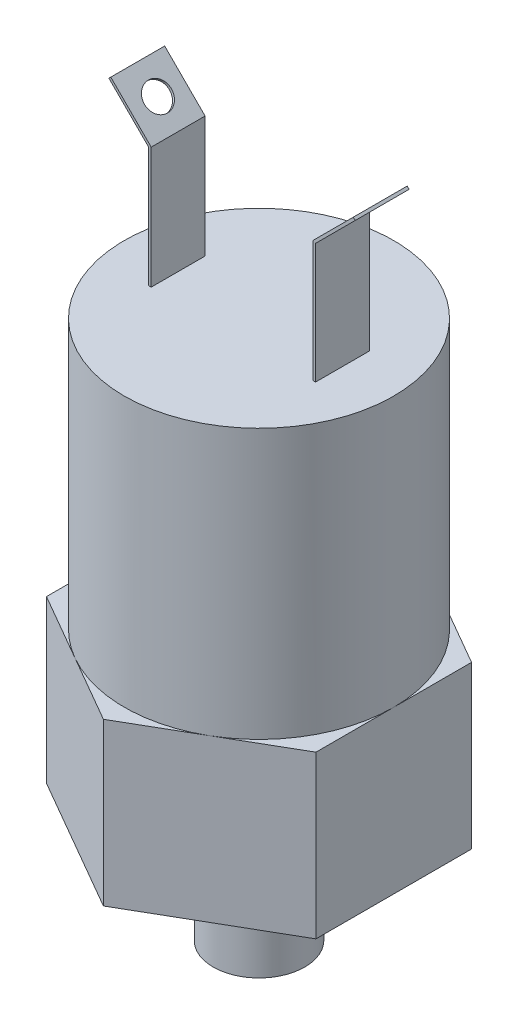
from build123d import *

# Parameters (mm, degrees)
SKETCH1_R           = 4.318
BOSS_EXTRUDE1_DEPTH = 10.16
BOSS_EXTRUDE2_DEPTH = 15.24
SKETCH3_R           = 12.7
BOSS_EXTRUDE3_DEPTH = 25.4
EXTRUDE_THIN1_DEPTH = 2.54
CUT_EXTRUDE1_REACH  = 59.583
SKETCH5_R           = 1.27


with BuildPart() as part:
    # Sketch1 → Boss-Extrude1 (new body)
    with BuildSketch(Plane(origin=(0, 0, 0), x_dir=(1, 0, 0), z_dir=(0, 1, 0))):
        with Locations(Location((0, 0, 0), (0, 0, 270))):
            Circle(SKETCH1_R)
    extrude(amount=BOSS_EXTRUDE1_DEPTH)

    # Sketch2 → Boss-Extrude2 (add)
    with BuildSketch(Plane(origin=(0, 10.16, 0), x_dir=(1, 0, 0), z_dir=(0, 1, 0))):
        Polygon((0, 14.664696837), (-12.7, 7.332348419), (-12.7, -7.332348419), (0, -14.664696837), (12.7, -7.332348419), (12.7, 7.332348419), align=None)
    extrude(amount=BOSS_EXTRUDE2_DEPTH)

    # Sketch3 → Boss-Extrude3 (add)
    with BuildSketch(Plane(origin=(0, 25.4, 0), x_dir=(1, 0, 0), z_dir=(0, 1, 0))):
        with Locations(Location((0, 0, 0), (0, 0, 60))):
            Circle(SKETCH3_R)
    extrude(amount=BOSS_EXTRUDE3_DEPTH)

    # Sketch4 → Extrude-Thin1 (add, symmetric)
    with BuildSketch(Plane.XY):
        Polygon((7.62, 50.8), (7.62, 62.23), (11.43, 66.04), (11.609605122, 65.860394878), (7.874, 62.124789755), (7.874, 50.8), align=None)
    extrude_thin1 = extrude(amount=EXTRUDE_THIN1_DEPTH, both=True)

    # Sketch5 → Cut-Extrude1 (cut, up to next)
    with BuildSketch(Plane(origin=(-27.305, 27.305, 0), x_dir=(0, 0, 1), z_dir=(-0.7071067811865452, 0.7071067811865498, 0)), mode=Mode.PRIVATE) as cut_extrude1_sk1:
        with Locations(Location((0, 52.085485502, 0), (0, 0, 270))):
            Circle(SKETCH5_R)
    cut_extrude1_tool1 = extrude(cut_extrude1_sk1.sketch, amount=-CUT_EXTRUDE1_REACH, mode=Mode.PRIVATE) & part.part
    cut_extrude1 = cut_extrude1_tool1.solids().sort_by_distance((9.525, 64.135, 0))[0]
    add(cut_extrude1, mode=Mode.SUBTRACT)

    # Mirror1: Extrude-Thin1, Cut-Extrude1 across plane
    add(extrude_thin1.mirror(Plane(origin=(0, 0, 0), x_dir=(0, 0, 1), z_dir=(1, 0, 0))))
    add(cut_extrude1.mirror(Plane(origin=(0, 0, 0), x_dir=(0, 0, 1), z_dir=(1, 0, 0))), mode=Mode.SUBTRACT)


solid = part.part
